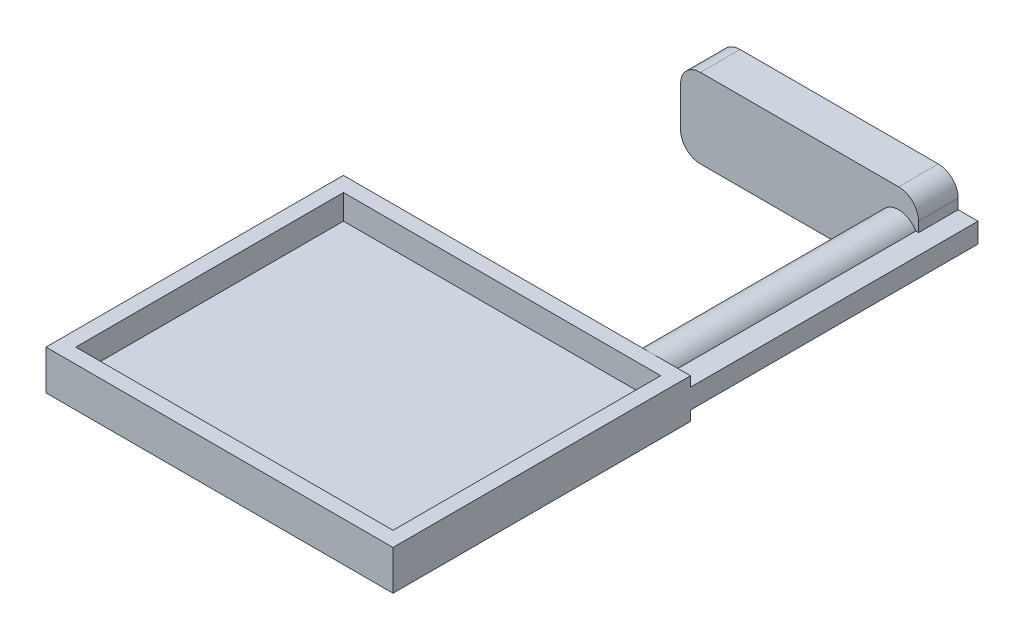
from build123d import *

# Parameters (mm, degrees)
EXTRUDE_1_DEPTH      = 5
EXTRUDE_1_DEPTH_BACK = 50
SKETCH_13_R          = 8.470611641
CUT_EXTRUDE_6_DEPTH  = 5
EXTRUDE_7_DEPTH      = 8
SKETCH_27_W          = 4
SKETCH_27_H          = 4
EXTRUDE_9_DEPTH      = 8
SKETCH_24_R          = 3.2
CUT_EXTRUDE_9_DEPTH  = 3.05
SKETCH_21_W          = 70
SKETCH_21_H          = 8
EXTRUDE_6_DEPTH      = 60
SKETCH_22_W          = 64
SKETCH_22_H          = 54
CUT_EXTRUDE_8_DEPTH  = 5


with BuildPart() as part:
    # ｽｹｯﾁ1 → ﾎﾞｽ - 押し出し1 (new, two sides: drawn at the far end of the back side and taken through both)
    with BuildSketch(Plane.XY.offset(-EXTRUDE_1_DEPTH_BACK)):
        with BuildLine():
            Line((3.464101615, 2), (8, 2))
            Line((8, 2), (8, -2))
            Line((8, -2), (3.464101615, -2))
            ThreePointArc((3.464101615, -2), (-4, 0), (3.464101615, 2))
        make_face()
    extrude(amount=EXTRUDE_1_DEPTH + EXTRUDE_1_DEPTH_BACK)

    # ｽｹｯﾁ13 → ｶｯﾄ - 押し出し6 (cut)
    with BuildSketch(Plane.XY.offset(5)):
        Circle(SKETCH_13_R)
    extrude(amount=-CUT_EXTRUDE_6_DEPTH, mode=Mode.SUBTRACT)

    # ｽｹｯﾁ23 → ﾎﾞｽ - 押し出し7 (add)
    with BuildSketch(Plane(origin=(0, 0, -50), x_dir=(-1, 0, 0), z_dir=(0, 0, -1))):
        with BuildLine():
            Line((-4, 4), (-4, -4))
            ThreePointArc((-4, -4), (-2.828427125, -6.828427125), (0, -8))
            Line((0, -8), (40, -8))
            ThreePointArc((40, -8), (42.828427125, -6.828427125), (44, -4))
            Line((44, -4), (44, 4))
            ThreePointArc((44, 4), (42.828427125, 6.828427125), (40, 8))
            Line((40, 8), (0, 8))
            ThreePointArc((0, 8), (-2.828427125, 6.828427125), (-4, 4))
        make_face()
    extrude(amount=EXTRUDE_7_DEPTH)

    # ｽｹｯﾁ27 → ﾎﾞｽ - 押し出し9 (add)
    with BuildSketch(Plane(origin=(0, 0, -50), x_dir=(-1, 0, 0), z_dir=(0, 0, -1))):
        with Locations((-6, 0)):
            Rectangle(SKETCH_27_W, SKETCH_27_H)
    extrude(amount=EXTRUDE_9_DEPTH)

    # ｽｹｯﾁ24 → ｶｯﾄ - 押し出し9 (cut)
    with BuildSketch(Plane(origin=(0, 0, -58), x_dir=(-1, 0, 0), z_dir=(0, 0, -1))):
        with Locations((0, 4)):
            Circle(SKETCH_24_R)
        with Locations((40, 4)):
            Circle(SKETCH_24_R)
        with Locations((40, -4)):
            Circle(SKETCH_24_R)
        with Locations((0, -4)):
            Circle(SKETCH_24_R)
        with Locations((10, 4)):
            Circle(SKETCH_24_R)
        with Locations((20, 4)):
            Circle(SKETCH_24_R)
        with Locations((30, 4)):
            Circle(SKETCH_24_R)
        with Locations((10, -4)):
            Circle(SKETCH_24_R)
        with Locations((20, -4)):
            Circle(SKETCH_24_R)
        with Locations((30, -4)):
            Circle(SKETCH_24_R)
    extrude(amount=-CUT_EXTRUDE_9_DEPTH, mode=Mode.SUBTRACT)

    # ｽｹｯﾁ21 → ﾎﾞｽ - 押し出し6 (add)
    with BuildSketch(Plane.XY):
        with Locations((-27, 0)):
            Rectangle(SKETCH_21_W, SKETCH_21_H)
    extrude(amount=EXTRUDE_6_DEPTH)

    # ｽｹｯﾁ22 → ｶｯﾄ - 押し出し8 (cut)
    with BuildSketch(Plane(origin=(0, 4, 0), x_dir=(1, 0, 0), z_dir=(0, 1, 0))):
        with Locations((-27, -30)):
            Rectangle(SKETCH_22_W, SKETCH_22_H)
    extrude(amount=-CUT_EXTRUDE_8_DEPTH, mode=Mode.SUBTRACT)


solid = part.part
